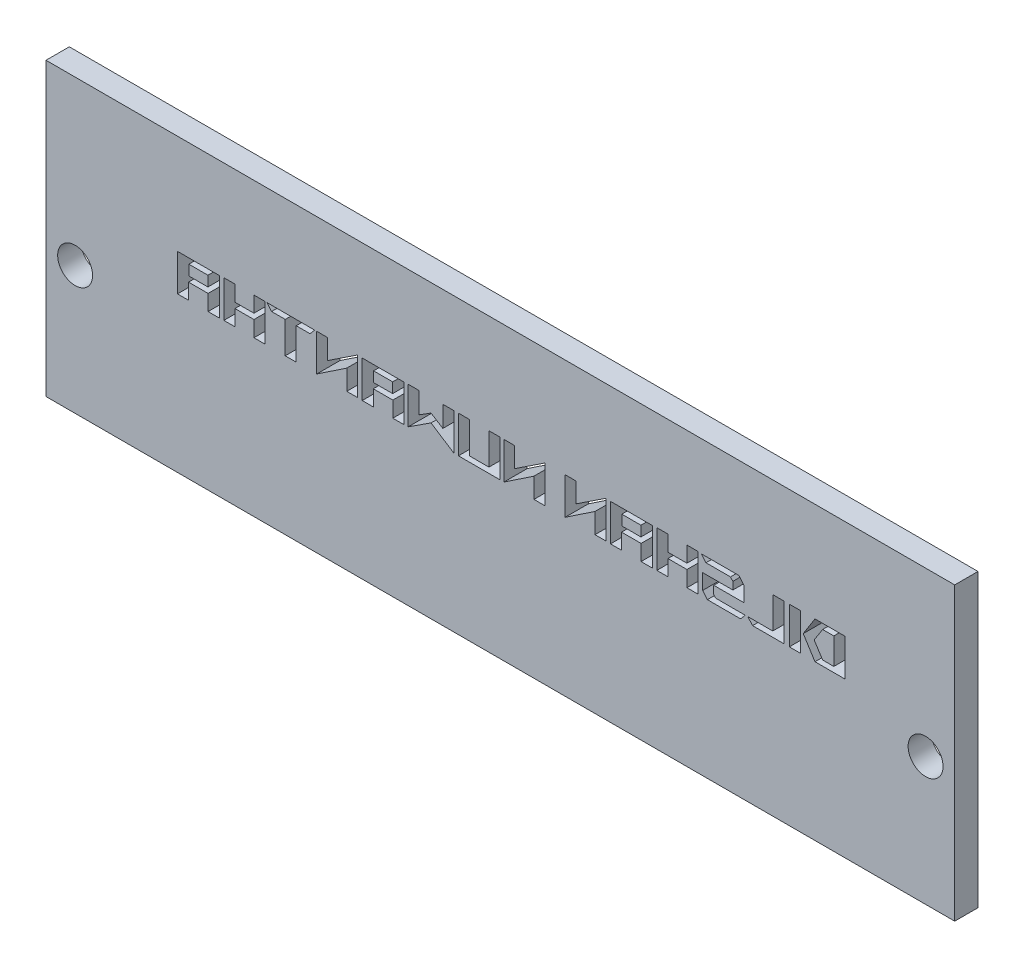
from build123d import *

# Parameters (mm, degrees)
SKETCH1_W           = 78
SKETCH1_H           = 25
BOSS_EXTRUDE1_DEPTH = 2
SKETCH2_R           = 1.5
CUT_EXTRUDE1_DEPTH  = 2
SKETCH3_W           = 0.951714292
SKETCH3_H           = 3.175
SKETCH3_W_2         = 1.64005667
SKETCH3_H_2         = 0.875681432
SKETCH3_W_3         = 1.640056671
CUT_EXTRUDE2_DEPTH  = 2


with BuildPart() as part:
    # Sketch1 → Boss-Extrude1 (new body)
    with BuildSketch(Plane.XY):
        Rectangle(SKETCH1_W, SKETCH1_H)
    extrude(amount=BOSS_EXTRUDE1_DEPTH)

    # Sketch2 → Cut-Extrude1 (cut)
    with BuildSketch(Plane.XY.offset(2)):
        with Locations((-36.5, -1.5)):
            Circle(SKETCH2_R)
        with Locations((36.5, -1.5)):
            Circle(SKETCH2_R)
    extrude(amount=-CUT_EXTRUDE1_DEPTH, mode=Mode.SUBTRACT)

    # Sketch3 → Cut-Extrude2 (cut)
    # profile 1 of 15: a face of its own
    with BuildSketch(Plane(origin=(0, 0, 0), x_dir=(-1, 0, 0), z_dir=(0, 0, -1))):
        Polygon((-29.575505362, 3.974938648), (-29.575505362, 0.792073246), (-27.006387116, 0.792073246), (-26.000606506, 2.378841305), (-27.006387116, 3.974938648), align=None)
        Polygon((-28.62379107, 3.518744687), (-27.663315893, 3.518744687), (-26.938428967, 2.378841305), (-27.663315893, 1.248266567), (-28.62379107, 1.248266567), align=None, mode=Mode.SUBTRACT)
    # profile 2 of 15: a face of its own
    with BuildSketch(Plane(origin=(0, 0, 0), x_dir=(-1, 0, 0), z_dir=(0, 0, -1))):
        with Locations((-25.282306406, 2.383505947)):
            Rectangle(SKETCH3_W, SKETCH3_H)
    # profile 3 of 15: a face of its own
    with BuildSketch(Plane(origin=(0, 0, 0), x_dir=(-1, 0, 0), z_dir=(0, 0, -1))):
        Polygon((-21.240800957, 1.263179338), (-21.649435094, 0.796005947), (-24.331903974, 0.796005947), (-24.331903974, 3.971005947), (-23.383281308, 3.971005947), (-23.383281308, 1.263179338), align=None)
    # profile 4 of 15: a face of its own
    with BuildSketch(Plane(origin=(0, 0, 0), x_dir=(-1, 0, 0), z_dir=(0, 0, -1))):
        Polygon((-17.360231248, 1.266912972), (-17.770588503, 0.786863569), (-20.616032764, 0.786863569), (-21.021880599, 1.253509528), (-18.483076923, 1.253509528), (-18.316228369, 1.445625558), (-18.316228369, 2.1291916), (-20.900126248, 2.1291916), (-20.900126248, 3.435661897), (-20.471731312, 3.938198874), (-17.251731841, 3.938198874), (-17.648834152, 3.471552915), (-19.754733471, 3.471552915), (-19.957657388, 3.242555011), (-19.957657388, 2.595871483), (-17.360231248, 2.595871483), align=None)
    # profile 5 of 15: a face of its own
    with BuildSketch(Plane(origin=(0, 0, 0), x_dir=(-1, 0, 0), z_dir=(0, 0, -1))):
        Polygon((-13.434390031, 3.971005947), (-13.434390031, 0.796005947), (-14.385030255, 0.796005947), (-14.385030255, 2.152169481), (-16.015818451, 2.152169481), (-16.015818451, 0.796005947), (-16.952845922, 0.796005947), (-16.952845922, 3.971005947), (-16.015818451, 3.971005947), (-16.015818451, 2.619342872), (-14.385030255, 2.619342872), (-14.385030255, 3.971005947), align=None)
    # profile 6 of 15: a face of its own
    with BuildSketch(Plane(origin=(0, 0, 0), x_dir=(-1, 0, 0), z_dir=(0, 0, -1))):
        Polygon((-9.451803728, 3.938198874), (-9.451803728, 0.774593081), (-10.403217818, 0.774593081), (-10.403217818, 2.124694981), (-12.079518835, 2.124694981), (-12.079518835, 0.774593081), (-13.049055099, 0.774593081), (-13.049055099, 3.938198874), align=None)
        with Locations((-11.24589887, 3.033712199)):
            Rectangle(SKETCH3_W_2, SKETCH3_H_2, mode=Mode.SUBTRACT)
    # profile 7 of 15: a face of its own
    with BuildSketch(Plane(origin=(0, 0, 0), x_dir=(-1, 0, 0), z_dir=(0, 0, -1))):
        Polygon((-5.548013544, 0.796005947), (-8.12614103, 2.524093928), (-8.12614103, 0.796005947), (-9.066469435, 0.796005947), (-9.066469435, 3.971005947), (-6.474942346, 2.256489753), (-6.474942346, 3.971005947), (-5.548013544, 3.971005947), align=None)
    # profile 8 of 15: a face of its own
    with BuildSketch(Plane(origin=(0, 0, 0), x_dir=(-1, 0, 0), z_dir=(0, 0, -1))):
        Polygon((-0.304412157, 0.796005947), (-2.882539642, 2.524093928), (-2.882539642, 0.796005947), (-3.822868048, 0.796005947), (-3.822868048, 3.971005947), (-1.231340959, 2.256489753), (-1.231340959, 3.971005947), (-0.304412157, 3.971005947), align=None)
    # profile 9 of 15: a face of its own
    with BuildSketch(Plane(origin=(0, 0, 0), x_dir=(-1, 0, 0), z_dir=(0, 0, -1))):
        Polygon((3.596827915, 3.971005947), (3.596827915, 0.796005947), (0.036422573, 0.796005947), (0.036422573, 3.971005947), (0.978642439, 3.971005947), (0.978642439, 1.263179338), (2.668296333, 1.263179338), (2.668296333, 3.971005947), align=None)
    # profile 10 of 15: a face of its own
    with BuildSketch(Plane(origin=(0, 0, 0), x_dir=(-1, 0, 0), z_dir=(0, 0, -1))):
        Polygon((5.948522329, 2.06770026), (7.913622117, 0.792072606), (7.913622117, 3.960191659), (6.961908466, 3.960191659), (6.961908466, 2.162693809), (5.948522329, 2.800372577), (4.93525781, 2.162693809), (4.93525781, 3.960191659), (3.983543518, 3.960191659), (3.983543518, 0.792072606), align=None)
    # profile 11 of 15: a face of its own
    with BuildSketch(Plane(origin=(0, 0, 0), x_dir=(-1, 0, 0), z_dir=(0, 0, -1))):
        Polygon((11.858192311, 3.938198874), (11.858192311, 0.774593081), (10.90677822, 0.774593081), (10.90677822, 2.124694981), (9.230477204, 2.124694981), (9.230477204, 0.774593081), (8.26094094, 0.774593081), (8.26094094, 3.938198874), align=None)
        with Locations((10.064097169, 3.033712199)):
            Rectangle(SKETCH3_W_3, SKETCH3_H_2, mode=Mode.SUBTRACT)
    # profile 12 of 15: a face of its own
    with BuildSketch(Plane(origin=(0, 0, 0), x_dir=(-1, 0, 0), z_dir=(0, 0, -1))):
        Polygon((15.761982494, 0.796005947), (13.183855009, 2.524093928), (13.183855009, 0.796005947), (12.243526603, 0.796005947), (12.243526603, 3.971005947), (14.835053692, 2.256489753), (14.835053692, 3.971005947), (15.761982494, 3.971005947), align=None)
    # profile 13 of 15: a face of its own
    with BuildSketch(Plane(origin=(0, 0, 0), x_dir=(-1, 0, 0), z_dir=(0, 0, -1))):
        Polygon((19.638198324, 3.503797351), (18.467108571, 3.503797351), (18.467108571, 0.796005947), (17.522097922, 0.796005947), (17.522097922, 3.503797351), (16.337443423, 3.503797351), (15.93502262, 3.971005947), (20.040761226, 3.971005947), align=None)
    # profile 14 of 15: a face of its own
    with BuildSketch(Plane(origin=(0, 0, 0), x_dir=(-1, 0, 0), z_dir=(0, 0, -1))):
        Polygon((23.732256603, 3.971005947), (23.732256603, 0.796005947), (22.781616379, 0.796005947), (22.781616379, 2.152169481), (21.150828183, 2.152169481), (21.150828183, 0.796005947), (20.213800712, 0.796005947), (20.213800712, 3.971005947), (21.150828183, 3.971005947), (21.150828183, 2.619342872), (22.781616379, 2.619342872), (22.781616379, 3.971005947), align=None)
    # profile 15 of 15: a face of its own
    with BuildSketch(Plane(origin=(0, 0, 0), x_dir=(-1, 0, 0), z_dir=(0, 0, -1))):
        Polygon((27.714842907, 3.938198874), (27.714842907, 0.774593081), (26.763428816, 0.774593081), (26.763428816, 2.124694981), (25.087127799, 2.124694981), (25.087127799, 0.774593081), (24.117591535, 0.774593081), (24.117591535, 3.938198874), align=None)
        with Locations((25.920747764, 3.033712199)):
            Rectangle(SKETCH3_W_2, SKETCH3_H_2, mode=Mode.SUBTRACT)
    extrude(amount=-CUT_EXTRUDE2_DEPTH, mode=Mode.SUBTRACT)


with BuildPart() as cut_extrude2_piece_1:
    # of the separate pieces the step leaves, piece 1, a body of its own (cut_extrude2_pieces)
    add(part.part.solids().sort_by_distance((-39, 12.5, 0))[0])


with BuildPart() as cut_extrude2_piece_2:
    # of the separate pieces the step leaves, piece 2, a body of its own (cut_extrude2_pieces)
    add(part.part.solids().sort_by_distance((28.62379107, 3.518744687, 0))[0])


with BuildPart() as cut_extrude2_piece_3:
    # of the separate pieces the step leaves, piece 3, a body of its own (cut_extrude2_pieces)
    add(part.part.solids().sort_by_distance((10.425870535, 3.471552915, 0))[0])


with BuildPart() as cut_extrude2_piece_4:
    # of the separate pieces the step leaves, piece 4, a body of its own (cut_extrude2_pieces)
    add(part.part.solids().sort_by_distance((-10.884125504, 3.471552915, 0))[0])


with BuildPart() as cut_extrude2_piece_5:
    # of the separate pieces the step leaves, piece 5, a body of its own (cut_extrude2_pieces)
    add(part.part.solids().sort_by_distance((-26.740776099, 3.471552915, 0))[0])


solid = Compound([cut_extrude2_piece_1.part, cut_extrude2_piece_2.part, cut_extrude2_piece_3.part, cut_extrude2_piece_4.part, cut_extrude2_piece_5.part])
